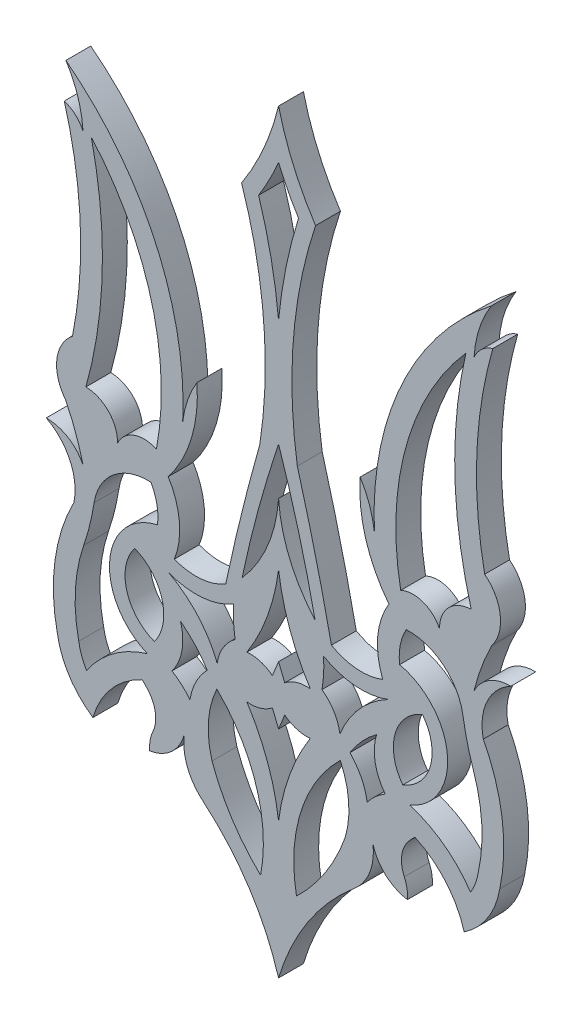
from build123d import *

# Parameters (mm, degrees)
EXTRUDE_1_DEPTH = 4
SCALE_1_SCALE   = 0.5


with BuildPart() as part:
    # Эскиз1 → Бобышка-Вытянуть1 (new body)
    with BuildSketch(Plane.XY):
        with BuildLine():
            ThreePointArc((-28.869752342, 50.617608587), (-31.423269263, 61.761829601), (-34.353639324, 72.812940041))
            ThreePointArc((-34.353639324, 72.812940041), (-34.970932252, 90.476060729), (-31.419547623, 107.789481829))
            ThreePointArc((-31.419547623, 107.789481829), (-34.987697143, 114.371940466), (-37.373069194, 121.469154911))
            ThreePointArc((-37.373069194, 121.469154911), (-39.758441245, 114.371940466), (-43.326590765, 107.789481829))
            ThreePointArc((-43.326590765, 107.789481829), (-39.775206135, 90.476060729), (-40.392499063, 72.812940041))
            ThreePointArc((-40.392499063, 72.812940041), (-43.322869124, 61.7618296), (-45.876386045, 50.617608586))
            ThreePointArc((-45.876386045, 50.617608586), (-49.93146094, 49.347732983), (-54.135510389, 49.965943856))
            ThreePointArc((-54.135510389, 49.965943856), (-53.325845654, 55.578947606), (-55.121750556, 60.958175586))
            ThreePointArc((-55.121750556, 60.958175586), (-51.373078228, 68.226639976), (-50.508806697, 76.359053735))
            ThreePointArc((-50.508806697, 76.359053735), (-52.001601375, 73.19728549), (-52.791896622, 69.791313116))
            ThreePointArc((-52.791896622, 69.791313116), (-57.174241581, 92.557254223), (-71.578616913, 110.723348825))
            ThreePointArc((-71.578616913, 110.723348825), (-69.652967118, 106.627915103), (-68.815570656, 102.180503309))
            ThreePointArc((-68.815570656, 102.180503309), (-70.02584128, 103.886668055), (-71.841031523, 104.926301408))
            ThreePointArc((-71.841031523, 104.926301408), (-69.260812636, 88.952208055), (-70.525282835, 72.820552743))
            ThreePointArc((-70.525282835, 72.820552743), (-73.032280655, 68.350580116), (-71.644247858, 63.417117001))
            ThreePointArc((-71.644247858, 63.417117001), (-70.009944702, 59.642428312), (-68.804965425, 55.709586281))
            ThreePointArc((-68.804965425, 55.709586281), (-71.252253225, 58.37925244), (-74.746138388, 59.332720559))
            ThreePointArc((-74.746138388, 59.332720559), (-70.90465692, 55.288376843), (-70.304759929, 49.742764203))
            ThreePointArc((-70.304759929, 49.742764203), (-73.335920261, 40.202520737), (-72.952542801, 30.199661142))
            ThreePointArc((-72.952542801, 30.199661142), (-71.009681957, 25.182479938), (-67.230171986, 21.353365175))
            ThreePointArc((-67.230171986, 21.353365175), (-64.280761011, 26.829167302), (-59.317151024, 30.57696798))
            ThreePointArc((-59.317151024, 30.57696798), (-58.707625279, 29.988103573), (-58.159889854, 29.341366511))
            ThreePointArc((-58.159889854, 29.341366511), (-57.162142674, 26.852646782), (-57.593575585, 24.206311399))
            ThreePointArc((-57.593575585, 24.206311399), (-58.038397423, 22.771930283), (-58.092472002, 21.271133296))
            ThreePointArc((-58.092472002, 21.271133296), (-54.565707511, 22.969836402), (-52.542818757, 26.321191516))
            ThreePointArc((-52.542818757, 26.321191516), (-52.022071345, 21.998013641), (-49.447655031, 18.486115942))
            ThreePointArc((-49.447655031, 18.486115942), (-42.067912648, 10.119906377), (-37.373069194, 0))
            ThreePointArc((-37.373069194, 0), (-32.67822574, 10.119906377), (-25.298483357, 18.486115942))
            ThreePointArc((-25.298483357, 18.486115942), (-22.724067042, 21.998013641), (-22.203319631, 26.321191516))
            ThreePointArc((-22.203319631, 26.321191516), (-20.180430876, 22.969836402), (-16.653666386, 21.271133297))
            ThreePointArc((-16.653666386, 21.271133297), (-16.707740965, 22.771930283), (-17.152562802, 24.206311399))
            ThreePointArc((-17.152562802, 24.206311399), (-17.583995714, 26.852646783), (-16.586248533, 29.341366511))
            ThreePointArc((-16.586248533, 29.341366511), (-16.038513109, 29.988103573), (-15.428987364, 30.57696798))
            ThreePointArc((-15.428987364, 30.57696798), (-10.465377377, 26.829167302), (-7.515966402, 21.353365175))
            ThreePointArc((-7.515966402, 21.353365175), (-3.73645643, 25.182479938), (-1.793595586, 30.199661142))
            ThreePointArc((-1.793595586, 30.199661142), (-1.410218127, 40.202520737), (-4.441378459, 49.742764203))
            ThreePointArc((-4.441378459, 49.742764203), (-3.841481467, 55.288376843), (0, 59.332720559))
            ThreePointArc((0, 59.332720559), (-3.493885162, 58.37925244), (-5.941172962, 55.709586281))
            ThreePointArc((-5.941172962, 55.709586281), (-4.736193685, 59.642428312), (-3.101890529, 63.417117001))
            ThreePointArc((-3.101890529, 63.417117001), (-1.713857732, 68.350580116), (-4.220855552, 72.820552743))
            ThreePointArc((-4.220855552, 72.820552743), (-5.485325751, 88.952208054), (-2.905106864, 104.926301408))
            ThreePointArc((-2.905106864, 104.926301408), (-4.720297107, 103.886668055), (-5.930567732, 102.180503308))
            ThreePointArc((-5.930567732, 102.180503308), (-5.09317127, 106.627915103), (-3.167521474, 110.723348824))
            ThreePointArc((-3.167521474, 110.723348824), (-17.571896806, 92.557254222), (-21.954241765, 69.791313116))
            ThreePointArc((-21.954241765, 69.791313116), (-22.744537012, 73.19728549), (-24.237331691, 76.359053735))
            ThreePointArc((-24.237331691, 76.359053735), (-23.373060159, 68.226639976), (-19.624387831, 60.958175586))
            ThreePointArc((-19.624387831, 60.958175586), (-21.420292733, 55.578947606), (-20.610627998, 49.965943857))
            ThreePointArc((-20.610627998, 49.965943857), (-24.814677447, 49.347732984), (-28.869752342, 50.617608587))
        make_face()
        with BuildLine():
            Line((-37.373069194, 44.060005091), (-38.367928674, 41.616645609))
            ThreePointArc((-38.367928674, 41.616645609), (-40.300056798, 42.63265866), (-42.473984051, 42.831258524))
            ThreePointArc((-42.473984051, 42.831258524), (-39.13984435, 49.575665591), (-37.373069194, 56.888805805))
            ThreePointArc((-37.373069194, 56.888805805), (-35.606294038, 49.575665591), (-32.272154336, 42.831258524))
            ThreePointArc((-32.272154336, 42.831258524), (-34.44608159, 42.63265866), (-36.378209714, 41.616645609))
            Line((-36.378209714, 41.616645609), (-37.373069194, 44.060005091))
        make_face(mode=Mode.SUBTRACT)
        with BuildLine():
            Line((-37.373069194, 34.691841378), (-36.378209714, 37.135200861))
            ThreePointArc((-36.378209714, 37.135200861), (-34.44608159, 36.11918781), (-32.272154336, 35.920587945))
            ThreePointArc((-32.272154336, 35.920587945), (-35.606294038, 29.176180878), (-37.373069194, 21.863040664))
            ThreePointArc((-37.373069194, 21.863040664), (-39.13984435, 29.176180878), (-42.473984051, 35.920587945))
            ThreePointArc((-42.473984051, 35.920587945), (-40.300056798, 36.11918781), (-38.367928674, 37.135200861))
            Line((-38.367928674, 37.135200861), (-37.373069194, 34.691841378))
        make_face(mode=Mode.SUBTRACT)
        with BuildLine():
            ThreePointArc((-37.373069194, 66.806069651), (-35.610107418, 59.322137572), (-31.505997677, 52.820325761))
            ThreePointArc((-31.505997677, 52.820325761), (-34.125795557, 63.684373825), (-37.373069194, 74.377647186))
            ThreePointArc((-37.373069194, 74.377647186), (-40.620342831, 63.684373825), (-43.240140711, 52.820325761))
            ThreePointArc((-43.240140711, 52.820325761), (-39.13603097, 59.322137572), (-37.373069194, 66.806069651))
        make_face(mode=Mode.SUBTRACT)
        with BuildLine():
            ThreePointArc((-47.304826547, 35.288646239), (-48.652696642, 30.154220777), (-48.073706021, 24.877493716))
            ThreePointArc((-48.073706021, 24.877493716), (-44.868067324, 18.410026379), (-40.259537886, 12.854334736))
            ThreePointArc((-40.259537886, 12.854334736), (-40.956823293, 24.958768405), (-47.304826547, 35.288646239))
        make_face(mode=Mode.SUBTRACT)
        with BuildLine():
            ThreePointArc((-54.52785013, 34.200341025), (-52.90648757, 37.830261907), (-53.141047553, 41.798904467))
            ThreePointArc((-53.141047553, 41.798904467), (-50.778109278, 39.668811254), (-48.854156896, 37.135200861))
            ThreePointArc((-48.854156896, 37.135200861), (-50.674377197, 34.595273953), (-51.635827913, 31.622052946))
            ThreePointArc((-51.635827913, 31.622052946), (-52.954767871, 33.05373055), (-54.52785013, 34.200341025))
        make_face(mode=Mode.SUBTRACT)
        with BuildLine():
            ThreePointArc((-55.041294563, 47.635803296), (-49.734816106, 46.855478821), (-44.61637784, 48.458354242))
            ThreePointArc((-44.61637784, 48.458354242), (-44.624310736, 46.05433224), (-44.359222143, 43.664957267))
            ThreePointArc((-44.359222143, 43.664957267), (-46.280240551, 41.578531912), (-47.241217791, 38.910198118))
            ThreePointArc((-47.241217791, 38.910198118), (-50.359053436, 43.972234893), (-55.041294563, 47.635803296))
        make_face(mode=Mode.SUBTRACT)
        with BuildLine():
            ThreePointArc((-57.34988377, 36.883548725), (-56.1071726, 43.369238251), (-60.517656803, 48.284126731))
            ThreePointArc((-60.517656803, 48.284126731), (-61.805253217, 41.785965358), (-57.34988377, 36.883548725))
        make_face(mode=Mode.SUBTRACT)
        with BuildLine():
            ThreePointArc((-58.464088866, 34.636381816), (-63.988508628, 31.855187699), (-68.251957059, 27.374421926))
            ThreePointArc((-68.251957059, 27.374421926), (-69.048751065, 29.052051741), (-69.512388864, 30.85048508))
            ThreePointArc((-69.512388864, 30.85048508), (-70.056429035, 37.776919295), (-68.71659385, 44.594273058))
            ThreePointArc((-68.71659385, 44.594273058), (-67.728577902, 47.947019941), (-67.037025263, 51.37321931))
            ThreePointArc((-67.037025263, 51.37321931), (-63.897381405, 56.836047657), (-57.910199472, 58.799083471))
            ThreePointArc((-57.910199472, 58.799083471), (-56.942121554, 56.178194671), (-56.845025484, 53.385918661))
            ThreePointArc((-56.845025484, 53.385918661), (-64.53743526, 44.605501766), (-58.464088866, 34.636381816))
        make_face(mode=Mode.SUBTRACT)
        with BuildLine():
            ThreePointArc((-57.017543492, 63.826107094), (-57.838196676, 84.176449237), (-67.50177862, 102.104781034))
            ThreePointArc((-67.50177862, 102.104781034), (-65.725120717, 84.417174575), (-68.364091158, 66.837533778))
            ThreePointArc((-68.364091158, 66.837533778), (-64.725233869, 65.259167946), (-63.268246387, 61.570034099))
            ThreePointArc((-63.268246387, 61.570034099), (-60.610142956, 63.992633553), (-57.017543492, 63.826107094))
        make_face(mode=Mode.SUBTRACT)
        with BuildLine():
            ThreePointArc((-37.373069194, 91.671324474), (-38.566768272, 99.637512083), (-40.584358361, 107.435870419))
            ThreePointArc((-40.584358361, 107.435870419), (-38.862373682, 110.452033262), (-37.373069194, 113.589618588))
            ThreePointArc((-37.373069194, 113.589618588), (-35.883764705, 110.452033262), (-34.161780026, 107.435870419))
            ThreePointArc((-34.161780026, 107.435870419), (-36.179370116, 99.637512083), (-37.373069194, 91.671324474))
        make_face(mode=Mode.SUBTRACT)
        with BuildLine():
            ThreePointArc((-21.605090834, 41.798904467), (-21.839650817, 37.830261907), (-20.218288257, 34.200341025))
            ThreePointArc((-20.218288257, 34.200341025), (-21.791370516, 33.05373055), (-23.110310475, 31.622052946))
            ThreePointArc((-23.110310475, 31.622052946), (-24.07176119, 34.595273953), (-25.891981491, 37.135200861))
            ThreePointArc((-25.891981491, 37.135200861), (-23.96802911, 39.668811254), (-21.605090834, 41.798904467))
        make_face(mode=Mode.SUBTRACT)
        with BuildLine():
            ThreePointArc((-34.486600502, 12.854334736), (-29.878071064, 18.410026379), (-26.672432366, 24.877493715))
            ThreePointArc((-26.672432366, 24.877493715), (-26.093441745, 30.154220777), (-27.441311841, 35.288646239))
            ThreePointArc((-27.441311841, 35.288646239), (-33.789315095, 24.958768405), (-34.486600502, 12.854334736))
        make_face(mode=Mode.SUBTRACT)
        with BuildLine():
            ThreePointArc((-17.396254617, 36.883548725), (-12.940885171, 41.785965359), (-14.228481585, 48.284126731))
            ThreePointArc((-14.228481585, 48.284126731), (-18.638965788, 43.369238251), (-17.396254617, 36.883548725))
        make_face(mode=Mode.SUBTRACT)
        with BuildLine():
            ThreePointArc((-6.494181329, 27.374421927), (-10.75762976, 31.855187699), (-16.282049522, 34.636381816))
            ThreePointArc((-16.282049522, 34.636381816), (-10.208703127, 44.605501766), (-17.901112904, 53.385918661))
            ThreePointArc((-17.901112904, 53.385918661), (-17.804016834, 56.178194671), (-16.835938915, 58.799083471))
            ThreePointArc((-16.835938915, 58.799083471), (-10.848756983, 56.836047657), (-7.709113125, 51.37321931))
            ThreePointArc((-7.709113125, 51.37321931), (-7.017560486, 47.947019941), (-6.029544537, 44.594273059))
            ThreePointArc((-6.029544537, 44.594273059), (-4.689709352, 37.776919296), (-5.233749524, 30.85048508))
            ThreePointArc((-5.233749524, 30.85048508), (-5.697387322, 29.052051741), (-6.494181329, 27.374421927))
        make_face(mode=Mode.SUBTRACT)
        with BuildLine():
            ThreePointArc((-30.129760547, 48.458354243), (-25.011322281, 46.855478821), (-19.704843824, 47.635803297))
            ThreePointArc((-19.704843824, 47.635803297), (-24.387084951, 43.972234894), (-27.504920596, 38.910198119))
            ThreePointArc((-27.504920596, 38.910198119), (-28.465897836, 41.578531912), (-30.386916245, 43.664957268))
            ThreePointArc((-30.386916245, 43.664957268), (-30.121827651, 46.05433224), (-30.129760547, 48.458354243))
        make_face(mode=Mode.SUBTRACT)
        with BuildLine():
            ThreePointArc((-11.477892, 61.570034099), (-14.135995431, 63.992633553), (-17.728594895, 63.826107093))
            ThreePointArc((-17.728594895, 63.826107093), (-16.907941711, 84.176449237), (-7.244359767, 102.104781034))
            ThreePointArc((-7.244359767, 102.104781034), (-9.02101767, 84.417174575), (-6.382047229, 66.837533778))
            ThreePointArc((-6.382047229, 66.837533778), (-10.020904518, 65.259167946), (-11.477892, 61.570034099))
        make_face(mode=Mode.SUBTRACT)
    extrude(amount=EXTRUDE_1_DEPTH)


with BuildPart() as part_1:
    # Масштаб1: scaled about (-37.373069194, 55.576221282, 2)
    add(part.part.scale(SCALE_1_SCALE).moved(Location((-18.686534597, 27.788110641, 1))))


solid = part_1.part
